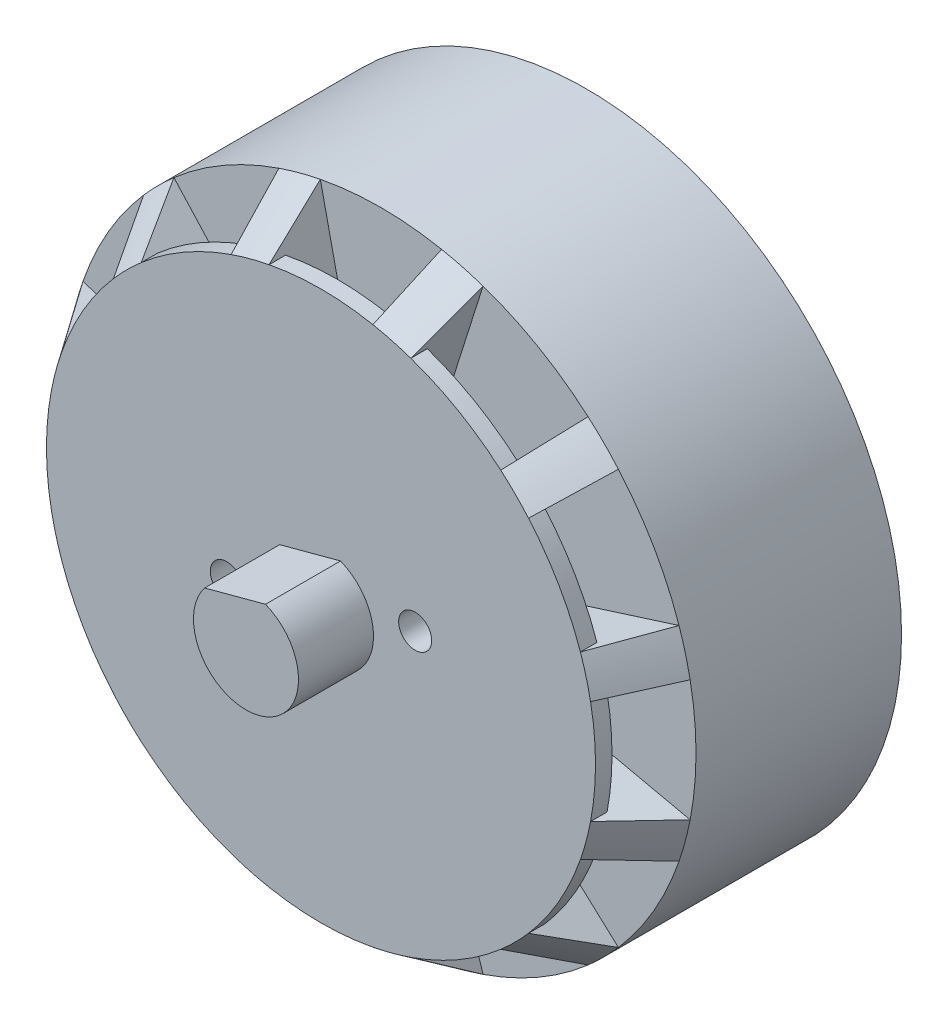
from build123d import *

# Parameters (mm, degrees)
SKETCH_1_R               = 21
EXTRUDE_1_DEPTH          = 13.7
SKETCH_3_R               = 21
SKETCH_2_R               = 18.3
CUT_EXTRUDE_START        = -4
CUT_EXTRUDE_1_DEPTH      = 4
PATTERN_CIRCULAR_1_COUNT = 12
SKETCH_5_R               = 18.3
EXTRUDE_2_DEPTH          = 1.1
EXTRUDE_3_DEPTH          = 5
SKETCH_8_R               = 3
EXTRUDE_4_DEPTH          = 4
SKETCH_9_R               = 1.1
CUT_EXTRUDE_3_DEPTH      = 4


with BuildPart() as part:
    # 草图1 → 凸台-拉伸1 (new body)
    with BuildSketch(Plane.XY):
        with Locations(Location((0, 0, 0), (0, 0, 191.095408705))):
            Circle(SKETCH_1_R)
    extrude(amount=EXTRUDE_1_DEPTH)

    # 草图3 → 放样1 section 0
    with BuildSketch(Plane.XY.offset(13.7)):
        Circle(SKETCH_3_R)
    # 草图2 → 放样1 section 1
    with BuildSketch(Plane.XY.offset(17.7)):
        Circle(SKETCH_2_R)
    loft()

    # 草图4 → 切除-拉伸1 (cut)
    with BuildSketch(Plane.XY.offset(17.7).offset(CUT_EXTRUDE_START)):
        with BuildLine():
            ThreePointArc((6.924234277, 1.027122038), (6.981032873, 0.51495634), (7, 0))
            Line((7, 0), (18.3, 0))
            ThreePointArc((18.3, 0), (18.217281615, 1.738001882), (17.969874258, 3.460291774))
            Line((17.969874258, 3.460291774), (6.924234277, 1.027122038))
        make_face()
        with BuildLine():
            Line((18.3, 0), (7, 0))
            ThreePointArc((7, 0), (6.981032873, -0.51495634), (6.924234277, -1.027122038))
            Line((6.924234277, -1.027122038), (17.969874258, -3.460291774))
            ThreePointArc((17.969874258, -3.460291774), (18.217281615, -1.738001882), (18.3, 0))
        make_face()
        with BuildLine():
            ThreePointArc((17.969874258, 3.460291774), (18.217281615, 1.738001882), (18.3, 0))
            Line((18.3, 0), (21, 0))
            ThreePointArc((21, 0), (20.9016371, 2.030164166), (20.607469853, 4.041309967))
            Line((20.607469853, 4.041309967), (17.969874258, 3.460291774))
        make_face()
        with BuildLine():
            Line((21, 0), (18.3, 0))
            ThreePointArc((18.3, 0), (18.217281615, -1.738001882), (17.969874258, -3.460291774))
            Line((17.969874258, -3.460291774), (20.607469853, -4.041309967))
            ThreePointArc((20.607469853, -4.041309967), (20.9016371, -2.030164166), (21, 0))
        make_face()
    cut_extrude_1 = extrude(amount=CUT_EXTRUDE_1_DEPTH, mode=Mode.SUBTRACT)

    # 阵列(圆周)1: 切除-拉伸1 ×12 about axis
    pattern_circular_1_axis = Axis((0, 0, 0), (0, 0, -1))
    for i in range(1, PATTERN_CIRCULAR_1_COUNT):
        add(cut_extrude_1.rotate(pattern_circular_1_axis, i * 360 / PATTERN_CIRCULAR_1_COUNT), mode=Mode.SUBTRACT)

    # 草图5 → 凸台-拉伸2 (add)
    with BuildSketch(Plane.XY.offset(17.7)):
        Circle(SKETCH_5_R)
    extrude(amount=-EXTRUDE_2_DEPTH)

    # 草图6 → 凸台-拉伸3 (add)
    with BuildSketch(Plane.XY.offset(17.7)):
        with BuildLine():
            Line((-2.753137561, 2.161072319), (1.303750909, 3.248112308))
            ThreePointArc((1.303750909, 3.248112308), (0.905866658, -3.380740392), (-2.753137561, 2.161072319))
        make_face()
    extrude(amount=EXTRUDE_3_DEPTH)

    # 草图8 → 凸台-拉伸4 (add)
    with BuildSketch(Plane.XY.offset(17.7)):
        with Locations((6.278517871, 1.682323793)):
            Circle(SKETCH_8_R)
        with Locations((-6.278517871, -1.682323793)):
            Circle(SKETCH_8_R)
    extrude(amount=-EXTRUDE_4_DEPTH)

    # 草图9 → 切除-拉伸3 (cut)
    with BuildSketch(Plane.XY.offset(17.7)):
        with Locations((6.278517871, 1.682323793)):
            Circle(SKETCH_9_R)
        with Locations((-6.278517871, -1.682323793)):
            Circle(SKETCH_9_R)
    extrude(amount=-CUT_EXTRUDE_3_DEPTH, mode=Mode.SUBTRACT)


solid = part.part
